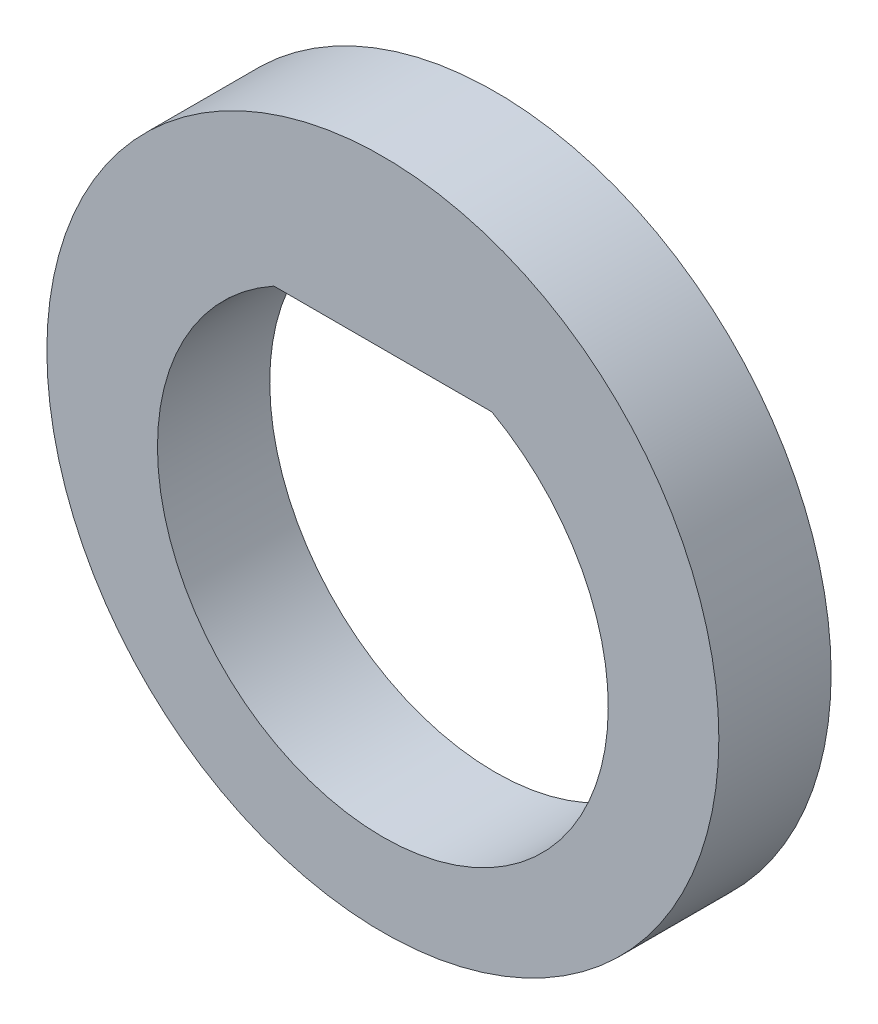
from build123d import *

# Parameters (mm, degrees)
SKETCH_1_R      = 5.985
EXTRUDE_1_DEPTH = 2


with BuildPart() as part:
    # 草图1 → 凸台-拉伸1 (new body)
    with BuildSketch(Plane.XY):
        Circle(SKETCH_1_R)
        with BuildLine():
            ThreePointArc((-1.940360791, 3.015), (0, -4.515), (1.940360791, 3.015))
            Line((1.940360791, 3.015), (-1.940360791, 3.015))
        make_face(mode=Mode.SUBTRACT)
    extrude(amount=EXTRUDE_1_DEPTH)


solid = part.part
